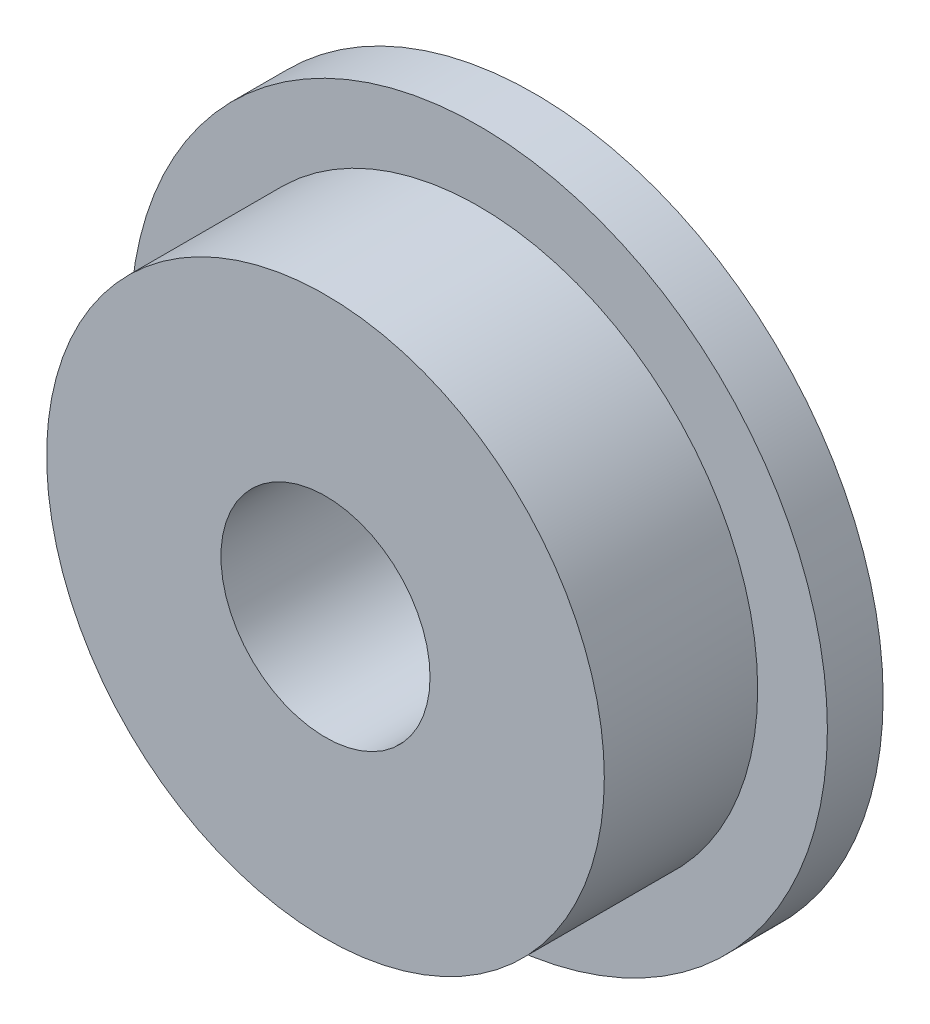
from build123d import *

# Parameters (mm, degrees)
SKETCH1_R           = 2.5
SKETCH1_R_2         = 0.75
BOSS_EXTRUDE1_DEPTH = 0.4
SKETCH2_R           = 2
SKETCH2_R_2         = 0.75
BOSS_EXTRUDE2_DEPTH = 1.1


with BuildPart() as part:
    # Sketch1 → Boss-Extrude1 (new body)
    with BuildSketch(Plane.XY):
        Circle(SKETCH1_R)
        Circle(SKETCH1_R_2, mode=Mode.SUBTRACT)
    extrude(amount=BOSS_EXTRUDE1_DEPTH)

    # Sketch2 → Boss-Extrude2 (add)
    with BuildSketch(Plane.XY.offset(0.4)):
        Circle(SKETCH2_R)
        Circle(SKETCH2_R_2, mode=Mode.SUBTRACT)
    extrude(amount=BOSS_EXTRUDE2_DEPTH)


solid = part.part
